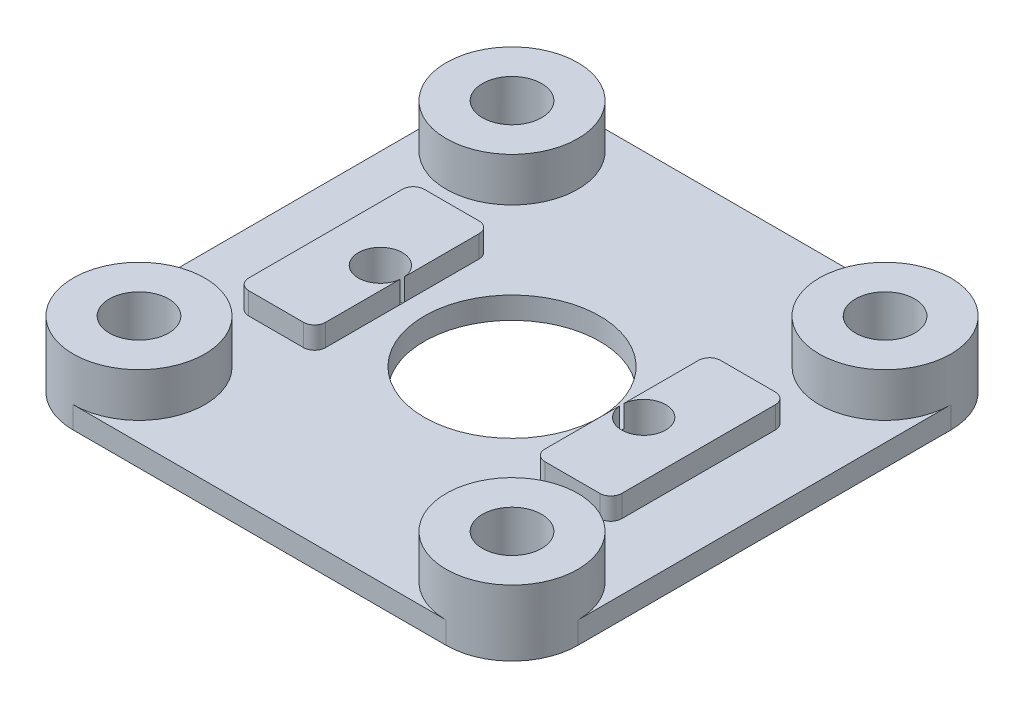
from build123d import *
from build123d.topology import SkipClean

# Parameters (mm, degrees)
SKETCH_1_W               = 23
SKETCH_1_H               = 23
EXTRUDE_1_DEPTH          = 2
SKETCH_2_R               = 1.35
CUT_EXTRUDE_1_DEPTH      = 2
PATTERN_CIRCULAR_1_COUNT = 4
FILLET_1_R               = 3
SKETCH_3_R               = 4
CUT_EXTRUDE_2_DEPTH      = 2
CUT_EXTRUDE_6_DEPTH      = 1
FILLET_2_R               = 0.5
CUT_EXTRUDE_7_DEPTH      = 2
PATTERN_CIRCULAR_2_COUNT = 2
EXTRUDE_START            = 1
SKETCH_6_R               = 3
SKETCH_6_R_2             = 1.35
EXTRUDE_2_DEPTH          = 1


with BuildPart() as part:
    # 草图1 → 凸台-拉伸1 (new body)
    with BuildSketch(Plane(origin=(0, 0, 0), x_dir=(1, 0, 0), z_dir=(0, 1, 0))):
        Rectangle(SKETCH_1_W, SKETCH_1_H)
    extrude(amount=EXTRUDE_1_DEPTH)

    # 草图2 → 切除-拉伸1 (cut)
    with BuildSketch(Plane(origin=(0, 2, 0), x_dir=(1, 0, 0), z_dir=(0, 1, 0))):
        with Locations((8.5, -8.5)):
            Circle(SKETCH_2_R)
    cut_extrude_1 = extrude(amount=-CUT_EXTRUDE_1_DEPTH, mode=Mode.SUBTRACT)

    # 阵列(圆周)1: 切除-拉伸1 ×4 about axis
    pattern_circular_1_axis = Axis((0, 0, 0), (0, 1, 0))
    for i in range(1, PATTERN_CIRCULAR_1_COUNT):
        add(cut_extrude_1.rotate(pattern_circular_1_axis, i * 360 / PATTERN_CIRCULAR_1_COUNT), mode=Mode.SUBTRACT)

    # 圆角1
    fillet_1_edges = [part.edges().sort_by_distance(p)[0] for p in [
        (-11.5, 1, 11.5),
        (11.5, 1, 11.5),
        (11.5, 1, -11.5),
        (-11.5, 1, -11.5),
    ]]
    fillet(fillet_1_edges, radius=FILLET_1_R)

    # 草图3 → 切除-拉伸2 (cut)
    with BuildSketch(Plane(origin=(0, 2, 0), x_dir=(1, 0, 0), z_dir=(0, 1, 0))):
        Circle(SKETCH_3_R)
    extrude(amount=-CUT_EXTRUDE_2_DEPTH, mode=Mode.SUBTRACT)

    # 草图4 → 切除-拉伸6 (cut)
    with SkipClean():  # the faces are left unmerged after this step: merging them gives an invalid solid
        with BuildSketch(Plane(origin=(0, 2, 0), x_dir=(1, 0, 0), z_dir=(0, 1, 0))):
            with BuildLine():
                ThreePointArc((-5.5, -8.5), (-6.37868, -10.62132), (-8.5, -11.5))
                Line((-8.5, -11.5), (8.5, -11.5))
                ThreePointArc((8.5, -11.5), (6.37868, -6.37868), (11.5, -8.5))
                Line((11.5, -8.5), (11.5, 8.5))
                ThreePointArc((11.5, 8.5), (6.37868, 6.37868), (8.5, 11.5))
                Line((8.5, 11.5), (-8.5, 11.5))
                ThreePointArc((-8.5, 11.5), (-6.37868, 10.62132), (-5.5, 8.5))
                ThreePointArc((-5.5, 8.5), (-8.5, 5.5), (-11.5, 8.5))
                Line((-11.5, 8.5), (-11.5, -8.5))
                ThreePointArc((-11.5, -8.5), (-8.5, -5.5), (-5.5, -8.5))
            make_face()
            Polygon((-5, 4), (-5, 0), (-5, -4), (-8.5, -4), (-8.5, 4), align=None, mode=Mode.SUBTRACT)
            with BuildLine():
                ThreePointArc((4, 0), (0, -4), (-4, 0))
                ThreePointArc((-4, 0), (0, 4), (4, 0))
            make_face(mode=Mode.SUBTRACT)
            Polygon((5, -4), (5, 0), (5, 4), (8.5, 4), (8.5, -4), align=None, mode=Mode.SUBTRACT)
        extrude(amount=-CUT_EXTRUDE_6_DEPTH, mode=Mode.SUBTRACT)

    # 圆角2
    fillet_2_edges = [part.edges().sort_by_distance(p)[0] for p in [
        (-8.5, 1.5, -4),
        (-5, 1.5, 4),
        (-5, 1.5, -4),
        (8.5, 1.5, 4),
        (8.5, 1.5, -4),
        (5, 1.5, -4),
        (5, 1.5, 4),
        (-8.5, 1.5, 4),
    ]]
    fillet(fillet_2_edges, radius=FILLET_2_R)

    # 草图5 → 切除-拉伸7 (cut)
    with SkipClean():  # the faces are left unmerged after this step: merging them gives an invalid solid
        with BuildSketch(Plane(origin=(0, 2, 0), x_dir=(1, 0, 0), z_dir=(0, 1, 0))):
            with BuildLine():
                ThreePointArc((4.995, 0), (6, -1.005), (7.005, 0))
                ThreePointArc((7.005, 0), (6, 1.005), (4.995, 0))
            make_face()
        cut_extrude_7 = extrude(amount=-CUT_EXTRUDE_7_DEPTH, mode=Mode.SUBTRACT)

    # 阵列(圆周)2: 切除-拉伸7 ×2 about axis
    with SkipClean():  # the faces are left unmerged after this step: merging them gives an invalid solid
        pattern_circular_2_axis = Axis((0, 0, 0), (0, 1, 0))
        for i in range(1, PATTERN_CIRCULAR_2_COUNT):
            add(cut_extrude_7.rotate(pattern_circular_2_axis, i * 360 / PATTERN_CIRCULAR_2_COUNT), mode=Mode.SUBTRACT)

    # 草图6 → 凸台-拉伸2 (add)
    # profile 1 of 4: a face of its own
    with SkipClean():  # the faces are left unmerged after this step: merging them gives an invalid solid
        with BuildSketch(Plane(origin=(0, 2, 0), x_dir=(1, 0, 0), z_dir=(0, 1, 0)).offset(EXTRUDE_START)):
            with Locations((-8.5, -8.5)):
                Circle(SKETCH_6_R)
            with Locations((-8.5, -8.5)):
                Circle(SKETCH_6_R_2, mode=Mode.SUBTRACT)
        # profile 2 of 4: a face of its own
        with BuildSketch(Plane(origin=(0, 2, 0), x_dir=(1, 0, 0), z_dir=(0, 1, 0)).offset(EXTRUDE_START)):
            with Locations((8.5, -8.5)):
                Circle(SKETCH_6_R)
            with Locations((8.5, -8.5)):
                Circle(SKETCH_6_R_2, mode=Mode.SUBTRACT)
        # profile 3 of 4: a face of its own
        with BuildSketch(Plane(origin=(0, 2, 0), x_dir=(1, 0, 0), z_dir=(0, 1, 0)).offset(EXTRUDE_START)):
            with Locations((8.5, 8.5)):
                Circle(SKETCH_6_R)
            with Locations((8.5, 8.5)):
                Circle(SKETCH_6_R_2, mode=Mode.SUBTRACT)
        # profile 4 of 4: a face of its own
        with BuildSketch(Plane(origin=(0, 2, 0), x_dir=(1, 0, 0), z_dir=(0, 1, 0)).offset(EXTRUDE_START)):
            with Locations((-8.5, 8.5)):
                Circle(SKETCH_6_R)
            with Locations((-8.5, 8.5)):
                Circle(SKETCH_6_R_2, mode=Mode.SUBTRACT)
        extrude(amount=-EXTRUDE_2_DEPTH)


solid = part.part
